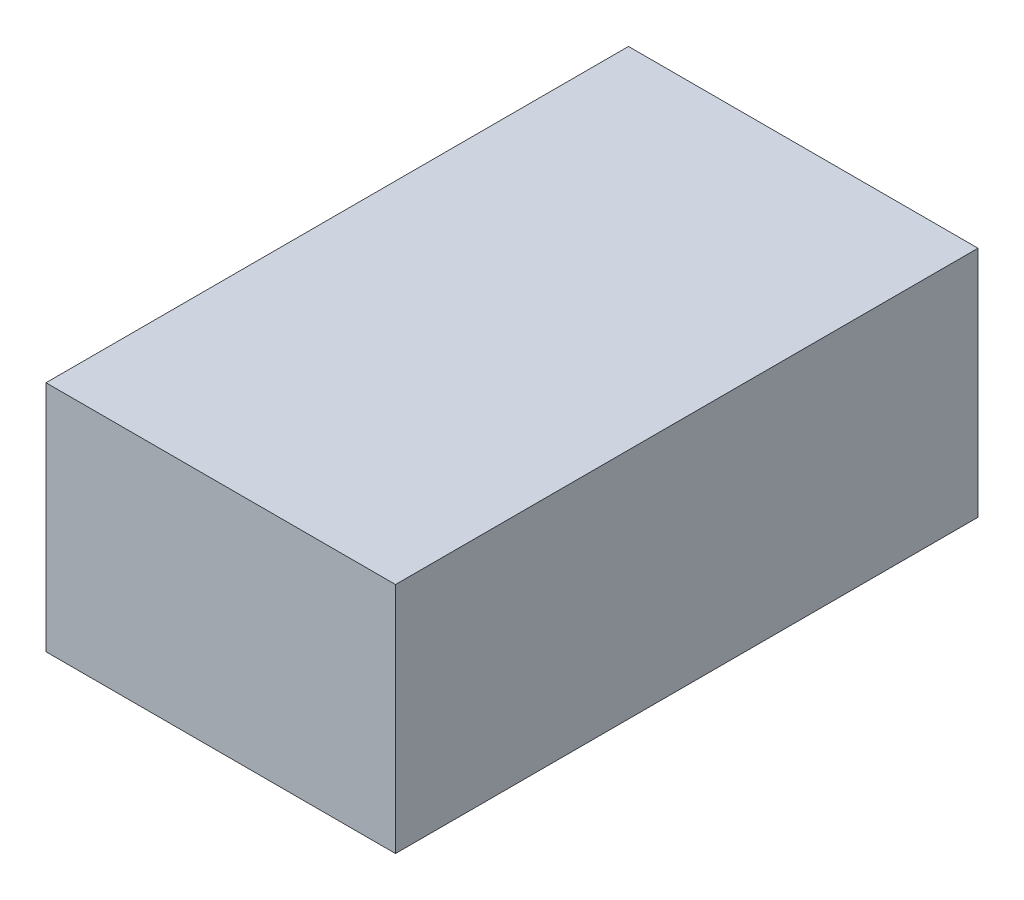
from build123d import *

# Parameters (mm, degrees)
SKETCH_1_W          = 60
SKETCH_1_H          = 40
EXTRUDE_1_DEPTH     = 100
SKETCH_2_R          = 4
CUT_EXTRUDE_1_DEPTH = 10


with BuildPart() as part:
    # 草图1 → 凸台-拉伸1 (new body)
    with BuildSketch(Plane.XY):
        Rectangle(SKETCH_1_W, SKETCH_1_H)
    extrude(amount=EXTRUDE_1_DEPTH)

    # 草图2 → 切除-拉伸1 (cut)
    with BuildSketch(Plane(origin=(0, 0, 0), x_dir=(-1, 0, 0), z_dir=(0, 0, -1))):
        Circle(SKETCH_2_R)
    extrude(amount=-CUT_EXTRUDE_1_DEPTH, mode=Mode.SUBTRACT)


solid = part.part
